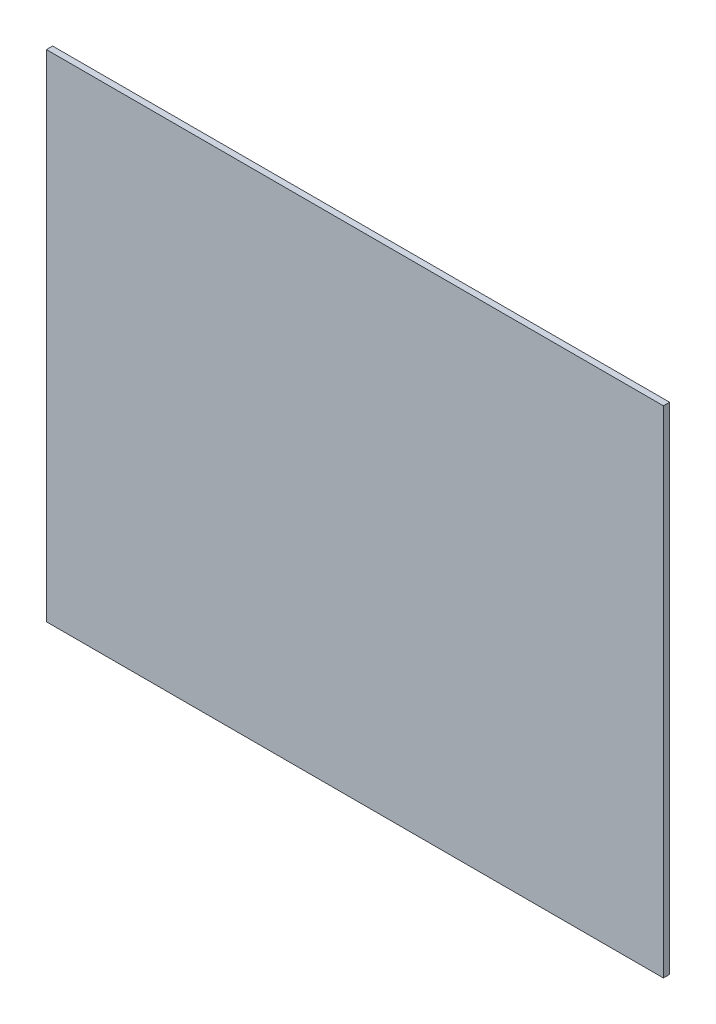
from build123d import *

# Parameters (mm, degrees)
SKETCH_1_W      = 99.6
SKETCH_1_H      = 80
EXTRUDE_1_DEPTH = 1


with BuildPart() as part:
    # 草图1 → 凸台-拉伸1 (new body)
    with BuildSketch(Plane.XY):
        with Locations((-42.642975207, 35.776859504)):
            Rectangle(SKETCH_1_W, SKETCH_1_H)
    extrude(amount=EXTRUDE_1_DEPTH)


solid = part.part
